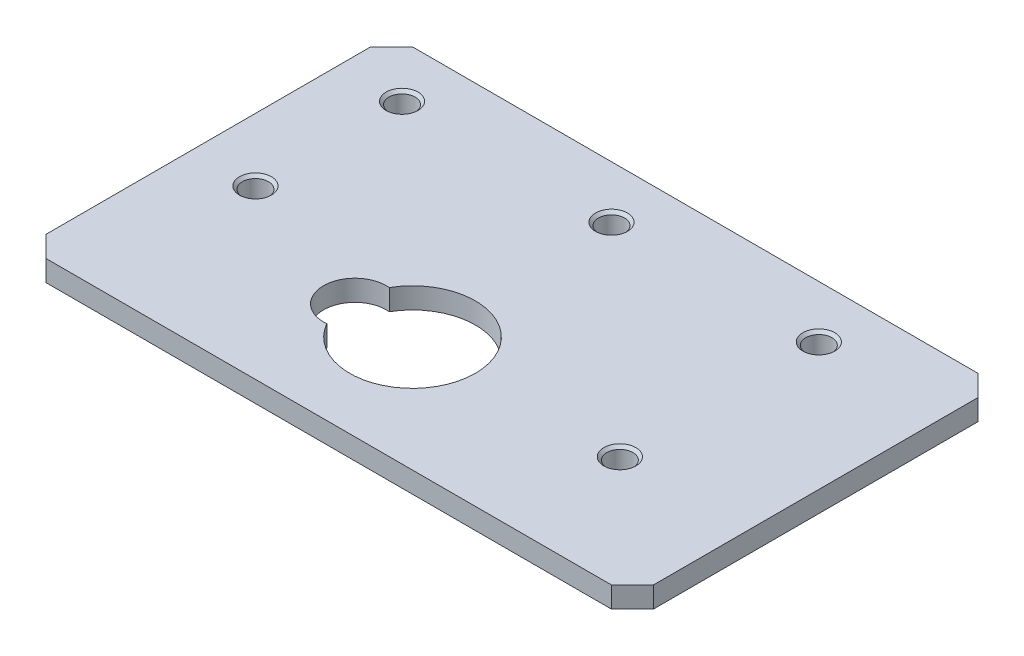
from build123d import *

# Parameters (mm, degrees)
SKETCH1_W                       = 58
SKETCH1_H                       = 35
BOSS_EXTRUDE1_DEPTH             = 2
M3X0_5_TAPPED_HOLE1_D           = 2.5
M3X0_5_TAPPED_HOLE1_CSINK_D     = 3.05
M3X0_5_TAPPED_HOLE1_CSINK_ANGLE = 90
CUT_EXTRUDE1_DEPTH              = 34.930075155
CHAMFER1_SIZE                   = 2


with BuildPart() as part:
    # Sketch1 → Boss-Extrude1 (new body)
    with BuildSketch(Plane(origin=(0, 0, 0), x_dir=(1, 0, 0), z_dir=(0, 1, 0))):
        Rectangle(SKETCH1_W, SKETCH1_H)
    extrude(amount=BOSS_EXTRUDE1_DEPTH)

    # M3x0.5 Tapped Hole1 (through all)
    with Locations(Plane(origin=(0, 2, 0), x_dir=(1, 0, 0), z_dir=(0, 1, 0))):
        with Locations((-23, 12.5), (-3, 12.5), (16.8, 12.5), (16.8, -6.5), (-23, -1.5)):
            CounterSinkHole(M3X0_5_TAPPED_HOLE1_D / 2, M3X0_5_TAPPED_HOLE1_CSINK_D / 2, counter_sink_angle=M3X0_5_TAPPED_HOLE1_CSINK_ANGLE)

    # Sketch4 → Cut-Extrude1 (cut, through all)
    with BuildSketch(Plane(origin=(0, 2, 0), x_dir=(1, 0, 0), z_dir=(0, 1, 0))):
        with BuildLine():
            ThreePointArc((-8.204545455, -3.514584349), (-11.5, -6.5), (-8.204545455, -9.485415651))
            ThreePointArc((-8.204545455, -9.485415651), (3, -6.5), (-8.204545455, -3.514584349))
        make_face()
    extrude(amount=-CUT_EXTRUDE1_DEPTH, mode=Mode.SUBTRACT)

    # Chamfer1
    chamfer1_edges = [part.edges().sort_by_distance(p)[0] for p in [
        (29, 1, 17.5),
        (-29, 1, 17.5),
        (-29, 1, -17.5),
        (29, 1, -17.5),
    ]]
    chamfer(chamfer1_edges, length=CHAMFER1_SIZE)


solid = part.part
